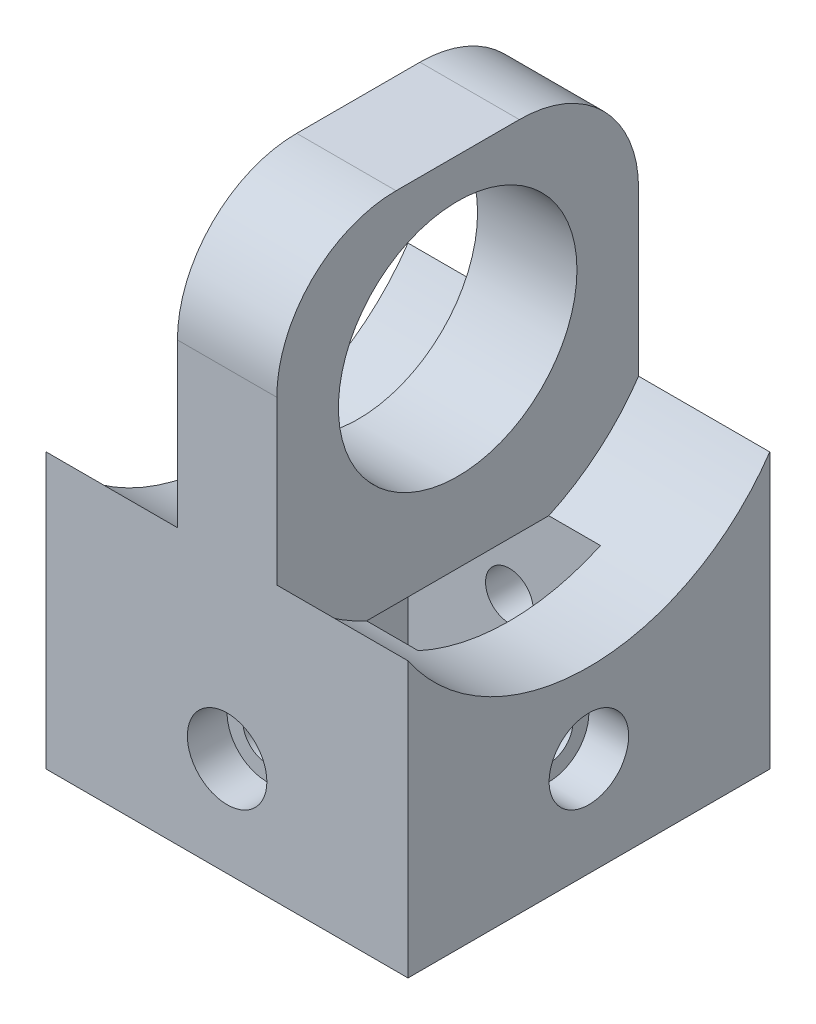
from build123d import *
from build123d.topology import SkipClean

# Parameters (mm, degrees)
SKETCH_1_W           = 9.1
SKETCH_1_H           = 9.1
SKETCH_1_W_2         = 5.1
SKETCH_1_H_2         = 5.1
EXTRUDE_1_DEPTH      = 5
SKETCH_2_R           = 0.6
CUT_EXTRUDE_1_DEPTH  = 12.336335387
SKETCH_2_3_R         = 1
CUT_EXTRUDE_2_DEPTH  = 1
CUT_EXTRUDE_START    = -8.1
SKETCH_2_4_R         = 1
CUT_EXTRUDE_3_DEPTH  = 1
SKETCH_3_R           = 0.6
CUT_EXTRUDE_4_DEPTH  = 12.336335387
SKETCH_3_3_R         = 1
CUT_EXTRUDE_5_DEPTH  = 1
SKETCH_3_4_R         = 1
CUT_EXTRUDE_6_DEPTH  = 1
SKETCH_5_W           = 9.1
SKETCH_5_H           = 9.1
EXTRUDE_2_DEPTH      = 1
EXTRUDE_START        = 1
SKETCH_5_4_W         = 2.5
SKETCH_5_4_H         = 9.1
EXTRUDE_3_DEPTH      = 8
SKETCH_6_R           = 3
CUT_EXTRUDE_7_DEPTH  = 16.822215395
FILLET_1_R           = 3
CUT_EXTRUDE_11_REACH = 19.306
CUT_EXTRUDE_START_2  = -5.8
CUT_EXTRUDE_12_DEPTH = 3.3
EXTRUDE_4_DEPTH      = 3.3
EXTRUDE_START_2      = -5.8
EXTRUDE_5_DEPTH      = 3.3


with BuildPart() as part:
    # 草图1 → 凸台-拉伸1 (new body)
    with BuildSketch(Plane(origin=(0, 0, 0), x_dir=(1, 0, 0), z_dir=(0, 1, 0))):
        Rectangle(SKETCH_1_W, SKETCH_1_H)
        Rectangle(SKETCH_1_W_2, SKETCH_1_H_2, mode=Mode.SUBTRACT)
    extrude(amount=EXTRUDE_1_DEPTH)

    # 草图2 → 切除-拉伸1 (cut, through all)
    with BuildSketch(Plane.XY.offset(4.55)):
        with Locations((0, 2.5)):
            Circle(SKETCH_2_R)
    extrude(amount=-CUT_EXTRUDE_1_DEPTH, mode=Mode.SUBTRACT)

    # 草图2<3> → 切除-拉伸2 (cut)
    with BuildSketch(Plane.XY.offset(4.55)):
        with Locations((0, 2.5)):
            Circle(SKETCH_2_3_R)
    extrude(amount=-CUT_EXTRUDE_2_DEPTH, mode=Mode.SUBTRACT)

    # 草图2<4> → 切除-拉伸3 (cut)
    with BuildSketch(Plane.XY.offset(4.55).offset(CUT_EXTRUDE_START)):
        with Locations((0, 2.5)):
            Circle(SKETCH_2_4_R)
    extrude(amount=-CUT_EXTRUDE_3_DEPTH, mode=Mode.SUBTRACT)

    # 草图3 → 切除-拉伸4 (cut, through all)
    with BuildSketch(Plane.ZY.offset(4.55)):
        with Locations((0, 2.5)):
            Circle(SKETCH_3_R)
    extrude(amount=-CUT_EXTRUDE_4_DEPTH, mode=Mode.SUBTRACT)

    # 草图3<3> → 切除-拉伸5 (cut)
    with BuildSketch(Plane.ZY.offset(4.55)):
        with Locations((0, 2.5)):
            Circle(SKETCH_3_3_R)
    extrude(amount=-CUT_EXTRUDE_5_DEPTH, mode=Mode.SUBTRACT)

    # 草图3<4> → 切除-拉伸6 (cut)
    with BuildSketch(Plane.ZY.offset(4.55).offset(CUT_EXTRUDE_START)):
        with Locations((0, 2.5)):
            Circle(SKETCH_3_4_R)
    extrude(amount=-CUT_EXTRUDE_6_DEPTH, mode=Mode.SUBTRACT)

    # 草图5 → 凸台-拉伸2 (add)
    with BuildSketch(Plane(origin=(0, 5, 0), x_dir=(1, 0, 0), z_dir=(0, 1, 0))):
        Rectangle(SKETCH_5_W, SKETCH_5_H)
    extrude(amount=EXTRUDE_2_DEPTH)

    # 草图5<4> → 凸台-拉伸3 (add)
    with BuildSketch(Plane(origin=(0, 5, 0), x_dir=(1, 0, 0), z_dir=(0, 1, 0)).offset(EXTRUDE_START)):
        Rectangle(SKETCH_5_4_W, SKETCH_5_4_H)
    extrude(amount=EXTRUDE_3_DEPTH)

    # 草图6 → 切除-拉伸7 (cut, through all)
    with BuildSketch(Plane(origin=(1.25, 0, 0), x_dir=(0, 0, -1), z_dir=(1, 0, 0))):
        with Locations((0, 10)):
            Circle(SKETCH_6_R)
    extrude(amount=-CUT_EXTRUDE_7_DEPTH, mode=Mode.SUBTRACT)

    # 圆角1
    fillet_1_edges = [part.edges().sort_by_distance(p)[0] for p in [
        (0, 14, 4.55),
        (0, 14, -4.55),
    ]]
    fillet(fillet_1_edges, radius=FILLET_1_R)

    # 切除-拉伸11: up to this face of the body (flat: up to its plane)
    cut_extrude_11_end = Plane(part.part.faces().sort_by_distance((1.25, 8.5, 4.428834823))[0])
    # 草图7 → 切除-拉伸11 (cut, up to the picked face)
    with BuildSketch(Plane(origin=(4.55, 0, 0), x_dir=(0, 0, -1), z_dir=(1, 0, 0)), mode=Mode.PRIVATE) as cut_extrude_11_sk1:
        with BuildLine():
            ThreePointArc((5.5, 10), (-1.616322988, 15.257138005), (-4.55, 6.910097089))
            ThreePointArc((-4.55, 6.910097089), (-4.187258154, 6.43392805), (-3.774917218, 6))
            Line((-3.774917218, 6), (3.774917218, 6))
            ThreePointArc((3.774917218, 6), (4.187258154, 6.43392805), (4.55, 6.910097089))
            ThreePointArc((4.55, 6.910097089), (5.257138005, 8.383677012), (5.5, 10))
        make_face()
    cut_extrude_11_tool1 = split(extrude(cut_extrude_11_sk1.sketch, amount=-CUT_EXTRUDE_11_REACH, mode=Mode.PRIVATE), bisect_by=cut_extrude_11_end, keep=Keep.BOTH, mode=Mode.PRIVATE)
    # 草图7 → 切除-拉伸11 (cut, up to the picked face)
    with BuildSketch(Plane(origin=(4.55, 0, 0), x_dir=(0, 0, -1), z_dir=(1, 0, 0)), mode=Mode.PRIVATE) as cut_extrude_11_sk2:
        with BuildLine():
            Line((3.774917218, 6), (-3.774917218, 6))
            ThreePointArc((-3.774917218, 6), (0, 4.5), (3.774917218, 6))
        make_face()
    cut_extrude_11_tool2 = split(extrude(cut_extrude_11_sk2.sketch, amount=-CUT_EXTRUDE_11_REACH, mode=Mode.PRIVATE), bisect_by=cut_extrude_11_end, keep=Keep.BOTH, mode=Mode.PRIVATE)
    add(cut_extrude_11_tool1.solids().sort_by(Axis((4.55, 10.411022, 0), (-1, 0, 0)))[0], mode=Mode.SUBTRACT)
    add(cut_extrude_11_tool2.solids().sort_by(Axis((4.55, 5.392383, 0), (-1, 0, 0)))[0], mode=Mode.SUBTRACT)

    # 草图7<2> → 切除-拉伸12 (cut)
    with BuildSketch(Plane(origin=(4.55, 0, 0), x_dir=(0, 0, -1), z_dir=(1, 0, 0)).offset(CUT_EXTRUDE_START_2)):
        with BuildLine():
            ThreePointArc((5.5, 10), (-1.616322988, 15.257138005), (-4.55, 6.910097089))
            ThreePointArc((-4.55, 6.910097089), (-4.187258154, 6.43392805), (-3.774917218, 6))
            Line((-3.774917218, 6), (3.774917218, 6))
            ThreePointArc((3.774917218, 6), (4.187258154, 6.43392805), (4.55, 6.910097089))
            ThreePointArc((4.55, 6.910097089), (5.257138005, 8.383677012), (5.5, 10))
        make_face()
        with BuildLine():
            Line((3.774917218, 6), (-3.774917218, 6))
            ThreePointArc((-3.774917218, 6), (0, 4.5), (3.774917218, 6))
        make_face()
    extrude(amount=-CUT_EXTRUDE_12_DEPTH, mode=Mode.SUBTRACT)

    # 草图7<5> → 凸台-拉伸4 (add)
    with SkipClean():  # the faces are left unmerged after this step: merging them gives an invalid solid
        with BuildSketch(Plane(origin=(4.55, 0, 0), x_dir=(0, 0, -1), z_dir=(1, 0, 0))):
            with BuildLine():
                ThreePointArc((-3.774917218, 6), (-4.187258154, 6.43392805), (-4.55, 6.910097089))
                Line((-4.55, 6.910097089), (-4.55, 6))
                Line((-4.55, 6), (-3.774917218, 6))
            make_face()
            with BuildLine():
                Line((4.55, 6), (4.55, 6.910097089))
                ThreePointArc((4.55, 6.910097089), (4.187258154, 6.43392805), (3.774917218, 6))
                Line((3.774917218, 6), (4.55, 6))
            make_face()
        extrude(amount=-EXTRUDE_4_DEPTH)

    # 草图7<6> → 凸台-拉伸5 (add)
    with SkipClean():  # the faces are left unmerged after this step: merging them gives an invalid solid
        with BuildSketch(Plane(origin=(4.55, 0, 0), x_dir=(0, 0, -1), z_dir=(1, 0, 0)).offset(EXTRUDE_START_2)):
            with BuildLine():
                ThreePointArc((-3.774917218, 6), (-4.187258154, 6.43392805), (-4.55, 6.910097089))
                Line((-4.55, 6.910097089), (-4.55, 6))
                Line((-4.55, 6), (-3.774917218, 6))
            make_face()
            with BuildLine():
                Line((4.55, 6), (4.55, 6.910097089))
                ThreePointArc((4.55, 6.910097089), (4.187258154, 6.43392805), (3.774917218, 6))
                Line((3.774917218, 6), (4.55, 6))
            make_face()
        extrude(amount=-EXTRUDE_5_DEPTH)


solid = part.part
